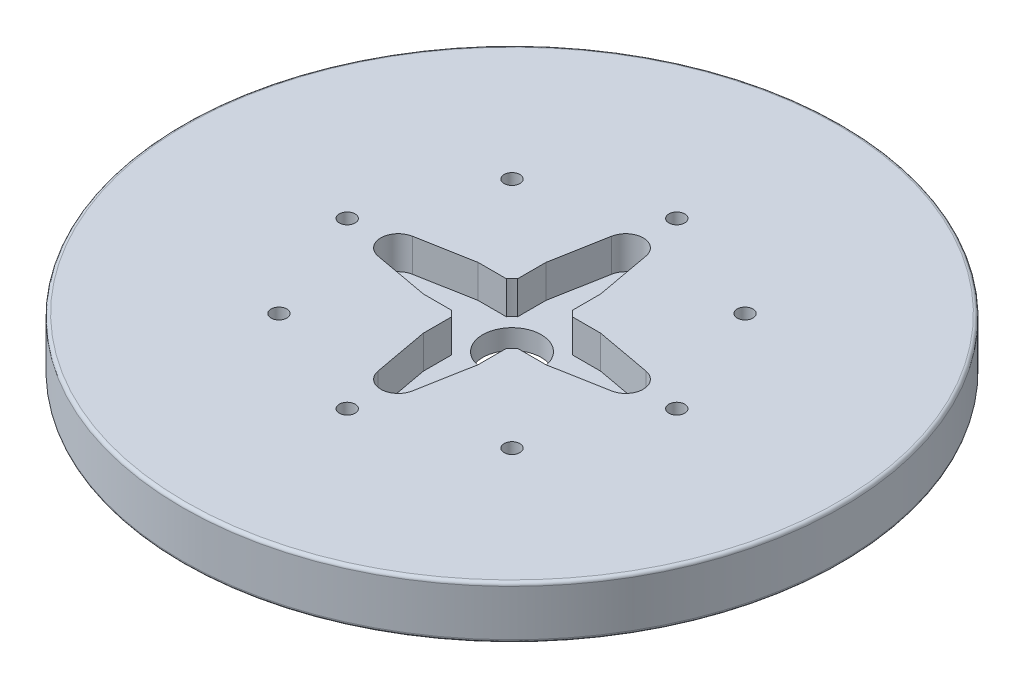
from build123d import *

# Parameters (mm, degrees)
SKETCH2_R           = 50
SKETCH2_R_2         = 1.2
BOSS_EXTRUDE1_DEPTH = 8
SKETCH3_R           = 19.9
SKETCH3_R_2         = 4.45
BOSS_EXTRUDE2_DEPTH = 3
SKETCH4_R           = 2.05
CUT_EXTRUDE2_DEPTH  = 3
FILLET1_R           = 1
FILLET2_R           = 0.5


with BuildPart() as part:
    # Sketch2 → Boss-Extrude1 (new body)
    with BuildSketch(Plane(origin=(0, 0, 0), x_dir=(1, 0, 0), z_dir=(0, 1, 0))):
        with Locations(Location((0, 0, 0), (0, 0, 270))):
            Circle(SKETCH2_R)
        with Locations(Location((25, 0, 0), (0, 0, 270))):
            Circle(SKETCH2_R_2, mode=Mode.SUBTRACT)
        with Locations(Location((17.67766953, -17.67766953, 0), (0, 0, 270))):
            Circle(SKETCH2_R_2, mode=Mode.SUBTRACT)
        with Locations(Location((0, -25, 0), (0, 0, 270))):
            Circle(SKETCH2_R_2, mode=Mode.SUBTRACT)
        with Locations(Location((-17.67766953, -17.67766953, 0), (0, 0, 270))):
            Circle(SKETCH2_R_2, mode=Mode.SUBTRACT)
        with Locations(Location((-25, 0, 0), (0, 0, 270))):
            Circle(SKETCH2_R_2, mode=Mode.SUBTRACT)
        with Locations(Location((-17.67766953, 17.67766953, 0), (0, 0, 270))):
            Circle(SKETCH2_R_2, mode=Mode.SUBTRACT)
        with Locations(Location((0, 25, 0), (0, 0, 270))):
            Circle(SKETCH2_R_2, mode=Mode.SUBTRACT)
        with Locations(Location((17.67766953, 17.67766953, 0), (0, 0, 270))):
            Circle(SKETCH2_R_2, mode=Mode.SUBTRACT)
        with BuildLine():
            Line((9.302749244, 4.15), (17.727520833, 2.606621157))
            ThreePointArc((17.727520833, 2.606621157), (19.9, 0), (17.727520833, -2.606621157))
            Line((17.727520833, -2.606621157), (9.302749244, -4.15))
            Line((9.302749244, -4.15), (5.002749244, -4.15))
            ThreePointArc((5.002749244, -4.15), (4.596194078, -4.596194078), (4.15, -5.002749244))
            Line((4.15, -5.002749244), (4.15, -9.302749244))
            Line((4.15, -9.302749244), (2.606621157, -17.727520833))
            ThreePointArc((2.606621157, -17.727520833), (0, -19.9), (-2.606621157, -17.727520833))
            Line((-2.606621157, -17.727520833), (-4.15, -9.302749244))
            Line((-4.15, -9.302749244), (-4.15, -5.002749244))
            ThreePointArc((-4.15, -5.002749244), (-4.596194078, -4.596194078), (-5.002749244, -4.15))
            Line((-5.002749244, -4.15), (-9.302749244, -4.15))
            Line((-9.302749244, -4.15), (-17.727520833, -2.606621157))
            ThreePointArc((-17.727520833, -2.606621157), (-19.9, 0), (-17.727520833, 2.606621157))
            Line((-17.727520833, 2.606621157), (-9.302749244, 4.15))
            Line((-9.302749244, 4.15), (-5.002749244, 4.15))
            ThreePointArc((-5.002749244, 4.15), (-4.596194078, 4.596194078), (-4.15, 5.002749244))
            Line((-4.15, 5.002749244), (-4.15, 9.302749244))
            Line((-4.15, 9.302749244), (-2.606621157, 17.727520833))
            ThreePointArc((-2.606621157, 17.727520833), (0, 19.9), (2.606621157, 17.727520833))
            Line((2.606621157, 17.727520833), (4.15, 9.302749244))
            Line((4.15, 9.302749244), (4.15, 5.002749244))
            ThreePointArc((4.15, 5.002749244), (4.596194078, 4.596194078), (5.002749244, 4.15))
            Line((5.002749244, 4.15), (9.302749244, 4.15))
        make_face(mode=Mode.SUBTRACT)
    extrude(amount=BOSS_EXTRUDE1_DEPTH)

    # Sketch3 → Boss-Extrude2 (add)
    with BuildSketch(Plane.XZ):
        Circle(SKETCH3_R)
        with Locations(Location((0, 0, 0), (0, 0, 270))):
            Circle(SKETCH3_R_2, mode=Mode.SUBTRACT)
    extrude(amount=-BOSS_EXTRUDE2_DEPTH)

    # Sketch4 → Cut-Extrude2 (cut)
    with BuildSketch(Plane.XZ):
        with Locations(Location((-17.67766953, 17.67766953, 0), (0, 0, 270))):
            Circle(SKETCH4_R)
        with Locations(Location((0, 25, 0), (0, 0, 270))):
            Circle(SKETCH4_R)
        with Locations(Location((-25, 0, 0), (0, 0, 270))):
            Circle(SKETCH4_R)
        with Locations(Location((0, 25, 0), (0, 0, 270))):
            Circle(SKETCH4_R)
        with Locations(Location((-17.67766953, -17.67766953, 0), (0, 0, 270))):
            Circle(SKETCH4_R)
        with Locations(Location((17.67766953, 17.67766953, 0), (0, 0, 270))):
            Circle(SKETCH4_R)
        with Locations(Location((0, -25, 0), (0, 0, 270))):
            Circle(SKETCH4_R)
        with Locations(Location((25, 0, 0), (0, 0, 270))):
            Circle(SKETCH4_R)
        with Locations(Location((17.67766953, -17.67766953, 0), (0, 0, 270))):
            Circle(SKETCH4_R)
        with Locations(Location((0, 25, 0), (0, 0, 270))):
            Circle(SKETCH4_R)
        with Locations(Location((17.67766953, 17.67766953, 0), (0, 0, 270))):
            Circle(SKETCH4_R)
        with Locations(Location((0, 25, 0), (0, 0, 270))):
            Circle(SKETCH4_R)
        with Locations(Location((25, 0, 0), (0, 0, 270))):
            Circle(SKETCH4_R)
        with Locations(Location((0, 25, 0), (0, 0, 270))):
            Circle(SKETCH4_R)
    extrude(amount=-CUT_EXTRUDE2_DEPTH, mode=Mode.SUBTRACT)

    # Fillet1
    fillet1_edges = [part.edges().sort_by_distance(p)[0] for p in [
        (-25, 0, 2.05),
        (-17.67766953, 0, -15.62766953),
        (0, 0, -22.95),
        (17.67766953, 0, -15.62766953),
        (0, 0, 27.05),
        (17.67766953, 0, 19.72766953),
        (25, 0, 2.05),
        (-17.67766953, 0, 19.72766953),
    ]]
    fillet(fillet1_edges, radius=FILLET1_R)

    # Fillet2
    fillet2_edges = [part.edges().sort_by_distance(p)[0] for p in [
        (0, 0, -50),
        (0, 8, -50),
    ]]
    fillet(fillet2_edges, radius=FILLET2_R)


solid = part.part
